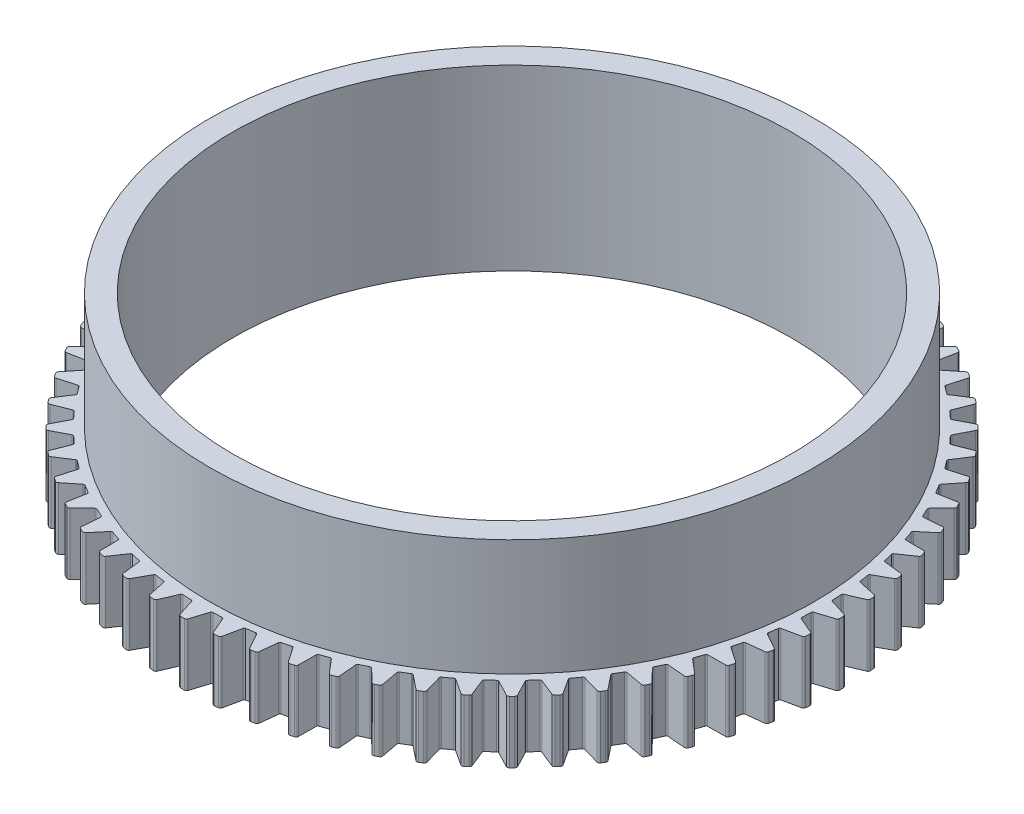
from build123d import *

# Parameters (mm, degrees)
SKETCH1_R           = 36
BOSS_EXTRUDE1_DEPTH = 8
SKETCH2_R           = 39
SKETCH2_R_2         = 36
BOSS_EXTRUDE2_DEPTH = 15


with BuildPart() as part:
    # Sketch1 → Boss-Extrude1 (new body)
    with BuildSketch(Plane(origin=(0, 0, 0), x_dir=(1, 0, 0), z_dir=(0, 1, 0))):
        with BuildLine():
            Line((-0.516428445, 42.290788925), (-1.207230425, 40.115163336))
            ThreePointArc((-1.207230425, 40.115163336), (-1.276964086, 40.016359136), (-1.390897576, 39.975810235))
            ThreePointArc((-1.390897576, 39.975810235), (-1.962706973, 39.951818248), (-2.534114577, 39.919647585))
            ThreePointArc((-2.534114577, 39.919647585), (-2.651473934, 39.948833797), (-2.730556314, 40.040327134))
            Line((-2.730556314, 40.040327134), (-3.631280492, 42.137766057))
            ThreePointArc((-3.631280492, 42.137766057), (-3.754372708, 42.277698039), (-3.936342379, 42.317943441))
            Line((-3.936342379, 42.317943441), (-4.395114549, 42.272758326))
            ThreePointArc((-4.395114549, 42.272758326), (-4.565736235, 42.197785707), (-4.659163894, 42.036528378))
            Line((-4.659163894, 42.036528378), (-5.133390874, 39.803668586))
            ThreePointArc((-5.133390874, 39.803668586), (-5.193104244, 39.698505061), (-5.302514626, 39.646983979))
            ThreePointArc((-5.302514626, 39.646983979), (-5.869218978, 39.567060399), (-6.434721822, 39.479036907))
            ThreePointArc((-6.434721822, 39.479036907), (-6.55437681, 39.49657935), (-6.642046302, 39.579880693))
            Line((-6.642046302, 39.579880693), (-7.744018213, 41.578933466))
            ThreePointArc((-7.744018213, 41.578933466), (-7.880233439, 41.706126491), (-8.065271615, 41.728341953))
            Line((-8.065271615, 41.728341953), (-8.517405756, 41.638406881))
            ThreePointArc((-8.517405756, 41.638406881), (-8.679857251, 41.547071426), (-8.757029047, 41.377433083))
            Line((-8.757029047, 41.377433083), (-9.010113964, 39.108842749))
            ThreePointArc((-9.010113964, 39.108842749), (-9.059231969, 38.998332681), (-9.163065561, 38.936335594))
            ThreePointArc((-9.163065561, 38.936335594), (-9.719207196, 38.801250128), (-10.273359178, 38.658221521))
            ThreePointArc((-10.273359178, 38.658221521), (-10.394157455, 38.663951254), (-10.489569754, 38.738258365))
            Line((-10.489569754, 38.738258365), (-11.782176804, 40.619673017))
            ThreePointArc((-11.782176804, 40.619673017), (-11.930203214, 40.732902146), (-12.116527877, 40.736873722))
            Line((-12.116527877, 40.736873722), (-12.55766969, 40.603054816))
            ThreePointArc((-12.55766969, 40.603054816), (-12.710386496, 40.496236135), (-12.770559223, 40.319850488))
            Line((-12.770559223, 40.319850488), (-12.80006473, 38.037377376))
            ThreePointArc((-12.80006473, 38.037377376), (-12.838114338, 37.922585038), (-12.935371166, 37.850709013))
            ThreePointArc((-12.935371166, 37.850709013), (-13.475594136, 37.661762607), (-14.01305847, 37.46510633))
            ThreePointArc((-14.01305847, 37.46510633), (-14.133836682, 37.458968171), (-14.236072915, 37.523565432))
            Line((-14.236072915, 37.523565432), (-15.706866593, 39.269222912))
            ThreePointArc((-15.706866593, 39.269222912), (-15.86527861, 39.367397686), (-16.051095352, 39.353087127))
            Line((-16.051095352, 39.353087127), (-16.476996399, 39.176673137))
            ThreePointArc((-16.476996399, 39.176673137), (-16.618507771, 39.055399952), (-16.661101934, 38.873965692))
            Line((-16.661101934, 38.873965692), (-16.466743876, 36.599591267))
            ThreePointArc((-16.466743876, 36.599591267), (-16.493358648, 36.481622172), (-16.583102075, 36.400559413))
            ThreePointArc((-16.583102075, 36.400559413), (-17.102203737, 36.159571725), (-17.617804348, 35.911181684))
            ThreePointArc((-17.617804348, 35.911181684), (-17.737399335, 35.893234747), (-17.845474911, 35.947500052))
            Line((-17.845474911, 35.947500052), (-19.48029067, 37.540588723))
            ThreePointArc((-19.48029067, 37.540588723), (-19.647562701, 37.622763666), (-19.831082004, 37.59030879))
            Line((-19.831082004, 37.59030879), (-20.237640627, 37.372998679))
            ThreePointArc((-20.237640627, 37.372998679), (-20.366583731, 37.238438918), (-20.391189124, 37.053703355))
            Line((-20.391189124, 37.053703355), (-19.974839276, 34.809331086))
            ThreePointArc((-19.974839276, 34.809331086), (-19.989762898, 34.68932134), (-20.071128646, 34.599852527))
            ThreePointArc((-20.071128646, 34.599852527), (-20.564109768, 34.3091444), (-21.052881139, 34.011412728))
            ThreePointArc((-21.052881139, 34.011412728), (-21.170141136, 33.981829851), (-21.283015229, 34.025240595))
            Line((-21.283015229, 34.025240595), (-23.066108899, 35.450418143))
            ThreePointArc((-23.066108899, 35.450418143), (-23.240630022, 35.515801865), (-23.420084495, 35.465515232))
            Line((-23.420084495, 35.465515232), (-23.803385311, 35.209401814))
            ThreePointArc((-23.803385311, 35.209401814), (-23.918518357, 35.062851361), (-23.924898017, 34.8765936))
            Line((-23.924898017, 34.8765936), (-23.290566055, 32.683838018))
            ThreePointArc((-23.290566055, 32.683838018), (-23.293654803, 32.562943381), (-23.365859276, 32.465930147))
            ThreePointArc((-23.365859276, 32.465930147), (-23.82797218, 32.128301259), (-24.285207176, 31.784095274))
            ThreePointArc((-24.285207176, 31.784095274), (-24.399002905, 31.743161358), (-24.515588475, 31.775299471))
            Line((-24.515588475, 31.775299471), (-26.42978789, 33.018840657))
            ThreePointArc((-26.42978789, 33.018840657), (-26.609877371, 33.066803477), (-26.78353877, 32.999169373))
            Line((-26.78353877, 32.999169373), (-27.139890384, 32.706719162))
            ThreePointArc((-27.139890384, 32.706719162), (-27.240104575, 32.549589378), (-27.228197062, 32.363603183))
            Line((-27.228197062, 32.363603183), (-26.381991951, 30.243581723))
            ThreePointArc((-26.381991951, 30.243581723), (-26.37321608, 30.122966477), (-26.435563908, 30.019343112))
            ThreePointArc((-26.435563908, 30.019343112), (-26.862358194, 29.638045014), (-27.283653392, 29.250679609))
            ThreePointArc((-27.283653392, 29.250679609), (-27.392888939, 29.198788868), (-27.512063203, 29.219344843))
            Line((-27.512063203, 29.219344843), (-29.538933575, 30.269273686))
            ThreePointArc((-29.538933575, 30.269273686), (-29.722857055, 30.299353696), (-29.889052926, 30.215023475))
            Line((-29.889052926, 30.215023475), (-30.215023475, 29.889052926))
            ThreePointArc((-30.215023475, 29.889052926), (-30.299353696, 29.722857055), (-30.269273686, 29.538933575))
            Line((-30.269273686, 29.538933575), (-29.219344843, 27.512063203))
            ThreePointArc((-29.219344843, 27.512063203), (-29.198788868, 27.392888939), (-29.250679609, 27.283653392))
            ThreePointArc((-29.250679609, 27.283653392), (-29.638045014, 26.862358194), (-30.019343112, 26.435563908))
            ThreePointArc((-30.019343112, 26.435563908), (-30.122966477, 26.37321608), (-30.243581723, 26.381991951))
            Line((-30.243581723, 26.381991951), (-32.363603183, 27.228197062))
            ThreePointArc((-32.363603183, 27.228197062), (-32.549589378, 27.240104575), (-32.706719162, 27.139890384))
            Line((-32.706719162, 27.139890384), (-32.999169373, 26.78353877))
            ThreePointArc((-32.999169373, 26.78353877), (-33.066803477, 26.609877371), (-33.018840657, 26.42978789))
            Line((-33.018840657, 26.42978789), (-31.775299471, 24.515588475))
            ThreePointArc((-31.775299471, 24.515588475), (-31.743161358, 24.399002905), (-31.784095274, 24.285207176))
            ThreePointArc((-31.784095274, 24.285207176), (-32.128301259, 23.82797218), (-32.465930147, 23.365859276))
            ThreePointArc((-32.465930147, 23.365859276), (-32.562943381, 23.293654803), (-32.683838018, 23.290566055))
            Line((-32.683838018, 23.290566055), (-34.8765936, 23.924898017))
            ThreePointArc((-34.8765936, 23.924898017), (-35.062851361, 23.918518357), (-35.209401814, 23.803385311))
            Line((-35.209401814, 23.803385311), (-35.465515232, 23.420084495))
            ThreePointArc((-35.465515232, 23.420084495), (-35.515801865, 23.240630022), (-35.450418143, 23.066108899))
            Line((-35.450418143, 23.066108899), (-34.025240595, 21.283015229))
            ThreePointArc((-34.025240595, 21.283015229), (-33.981829851, 21.170141136), (-34.011412728, 21.052881139))
            ThreePointArc((-34.011412728, 21.052881139), (-34.3091444, 20.564109768), (-34.599852527, 20.071128646))
            ThreePointArc((-34.599852527, 20.071128646), (-34.68932134, 19.989762898), (-34.809331086, 19.974839276))
            Line((-34.809331086, 19.974839276), (-37.053703355, 20.391189124))
            ThreePointArc((-37.053703355, 20.391189124), (-37.238438918, 20.366583731), (-37.372998679, 20.237640627))
            Line((-37.372998679, 20.237640627), (-37.59030879, 19.831082004))
            ThreePointArc((-37.59030879, 19.831082004), (-37.622763666, 19.647562701), (-37.540588723, 19.48029067))
            Line((-37.540588723, 19.48029067), (-35.947500052, 17.845474911))
            ThreePointArc((-35.947500052, 17.845474911), (-35.893234747, 17.737399335), (-35.911181684, 17.617804348))
            ThreePointArc((-35.911181684, 17.617804348), (-36.159571725, 17.102203737), (-36.400559413, 16.583102075))
            ThreePointArc((-36.400559413, 16.583102075), (-36.481622172, 16.493358648), (-36.599591267, 16.466743876))
            Line((-36.599591267, 16.466743876), (-38.873965692, 16.661101934))
            ThreePointArc((-38.873965692, 16.661101934), (-39.055399952, 16.618507771), (-39.176673137, 16.476996399))
            Line((-39.176673137, 16.476996399), (-39.353087127, 16.051095352))
            ThreePointArc((-39.353087127, 16.051095352), (-39.367397686, 15.86527861), (-39.269222912, 15.706866593))
            Line((-39.269222912, 15.706866593), (-37.523565432, 14.236072915))
            ThreePointArc((-37.523565432, 14.236072915), (-37.458968171, 14.133836682), (-37.46510633, 14.01305847))
            ThreePointArc((-37.46510633, 14.01305847), (-37.661762607, 13.475594136), (-37.850709013, 12.935371166))
            ThreePointArc((-37.850709013, 12.935371166), (-37.922585038, 12.838114338), (-38.037377376, 12.80006473))
            Line((-38.037377376, 12.80006473), (-40.319850488, 12.770559223))
            ThreePointArc((-40.319850488, 12.770559223), (-40.496236135, 12.710386496), (-40.603054816, 12.55766969))
            Line((-40.603054816, 12.55766969), (-40.736873722, 12.116527877))
            ThreePointArc((-40.736873722, 12.116527877), (-40.732902146, 11.930203214), (-40.619673017, 11.782176804))
            Line((-40.619673017, 11.782176804), (-38.738258365, 10.489569754))
            ThreePointArc((-38.738258365, 10.489569754), (-38.663951254, 10.394157455), (-38.658221521, 10.273359178))
            ThreePointArc((-38.658221521, 10.273359178), (-38.801250128, 9.719207196), (-38.936335594, 9.163065561))
            ThreePointArc((-38.936335594, 9.163065561), (-38.998332681, 9.059231969), (-39.108842749, 9.010113964))
            Line((-39.108842749, 9.010113964), (-41.377433083, 8.757029047))
            ThreePointArc((-41.377433083, 8.757029047), (-41.547071426, 8.679857251), (-41.638406881, 8.517405756))
            Line((-41.638406881, 8.517405756), (-41.728341953, 8.065271615))
            ThreePointArc((-41.728341953, 8.065271615), (-41.706126491, 7.880233439), (-41.578933466, 7.744018213))
            Line((-41.578933466, 7.744018213), (-39.579880693, 6.642046302))
            ThreePointArc((-39.579880693, 6.642046302), (-39.49657935, 6.55437681), (-39.479036907, 6.434721822))
            ThreePointArc((-39.479036907, 6.434721822), (-39.567060399, 5.869218978), (-39.646983979, 5.302514626))
            ThreePointArc((-39.646983979, 5.302514626), (-39.698505061, 5.193104244), (-39.803668586, 5.133390874))
            Line((-39.803668586, 5.133390874), (-42.036528378, 4.659163894))
            ThreePointArc((-42.036528378, 4.659163894), (-42.197785707, 4.565736235), (-42.272758326, 4.395114549))
            Line((-42.272758326, 4.395114549), (-42.317943441, 3.936342379))
            ThreePointArc((-42.317943441, 3.936342379), (-42.277698039, 3.754372708), (-42.137766057, 3.631280492))
            Line((-42.137766057, 3.631280492), (-40.040327134, 2.730556314))
            ThreePointArc((-40.040327134, 2.730556314), (-39.948833797, 2.651473934), (-39.919647585, 2.534114577))
            ThreePointArc((-39.919647585, 2.534114577), (-39.951818248, 1.962706973), (-39.975810235, 1.390897576))
            ThreePointArc((-39.975810235, 1.390897576), (-40.016359136, 1.276964086), (-40.115163336, 1.207230425))
            Line((-40.115163336, 1.207230425), (-42.290788925, 0.516428445))
            ThreePointArc((-42.290788925, 0.516428445), (-42.442112244, 0.407644684), (-42.5, 0.230495986))
            Line((-42.5, 0.230495986), (-42.5, -0.230495986))
            ThreePointArc((-42.5, -0.230495986), (-42.442112244, -0.407644684), (-42.290788925, -0.516428445))
            Line((-42.290788925, -0.516428445), (-40.115163336, -1.207230425))
            ThreePointArc((-40.115163336, -1.207230425), (-40.016359136, -1.276964086), (-39.975810235, -1.390897576))
            ThreePointArc((-39.975810235, -1.390897576), (-39.951818248, -1.962706973), (-39.919647585, -2.534114577))
            ThreePointArc((-39.919647585, -2.534114577), (-39.948833797, -2.651473934), (-40.040327134, -2.730556314))
            Line((-40.040327134, -2.730556314), (-42.137766057, -3.631280492))
            ThreePointArc((-42.137766057, -3.631280492), (-42.277698039, -3.754372708), (-42.317943441, -3.936342379))
            Line((-42.317943441, -3.936342379), (-42.272758326, -4.395114549))
            ThreePointArc((-42.272758326, -4.395114549), (-42.197785707, -4.565736235), (-42.036528378, -4.659163894))
            Line((-42.036528378, -4.659163894), (-39.803668586, -5.133390874))
            ThreePointArc((-39.803668586, -5.133390874), (-39.698505061, -5.193104244), (-39.646983979, -5.302514626))
            ThreePointArc((-39.646983979, -5.302514626), (-39.567060399, -5.869218978), (-39.479036907, -6.434721822))
            ThreePointArc((-39.479036907, -6.434721822), (-39.49657935, -6.55437681), (-39.579880693, -6.642046302))
            Line((-39.579880693, -6.642046302), (-41.578933466, -7.744018213))
            ThreePointArc((-41.578933466, -7.744018213), (-41.706126491, -7.880233439), (-41.728341953, -8.065271615))
            Line((-41.728341953, -8.065271615), (-41.638406881, -8.517405756))
            ThreePointArc((-41.638406881, -8.517405756), (-41.547071426, -8.679857251), (-41.377433083, -8.757029047))
            Line((-41.377433083, -8.757029047), (-39.108842749, -9.010113964))
            ThreePointArc((-39.108842749, -9.010113964), (-38.998332681, -9.059231969), (-38.936335594, -9.163065561))
            ThreePointArc((-38.936335594, -9.163065561), (-38.801250128, -9.719207196), (-38.658221521, -10.273359178))
            ThreePointArc((-38.658221521, -10.273359178), (-38.663951254, -10.394157455), (-38.738258365, -10.489569754))
            Line((-38.738258365, -10.489569754), (-40.619673017, -11.782176804))
            ThreePointArc((-40.619673017, -11.782176804), (-40.732902146, -11.930203214), (-40.736873722, -12.116527877))
            Line((-40.736873722, -12.116527877), (-40.603054816, -12.55766969))
            ThreePointArc((-40.603054816, -12.55766969), (-40.496236135, -12.710386496), (-40.319850488, -12.770559223))
            Line((-40.319850488, -12.770559223), (-38.037377376, -12.80006473))
            ThreePointArc((-38.037377376, -12.80006473), (-37.922585038, -12.838114338), (-37.850709013, -12.935371166))
            ThreePointArc((-37.850709013, -12.935371166), (-37.661762607, -13.475594136), (-37.46510633, -14.01305847))
            ThreePointArc((-37.46510633, -14.01305847), (-37.458968171, -14.133836682), (-37.523565432, -14.236072915))
            Line((-37.523565432, -14.236072915), (-39.269222912, -15.706866593))
            ThreePointArc((-39.269222912, -15.706866593), (-39.367397686, -15.86527861), (-39.353087127, -16.051095352))
            Line((-39.353087127, -16.051095352), (-39.176673137, -16.476996399))
            ThreePointArc((-39.176673137, -16.476996399), (-39.055399952, -16.618507771), (-38.873965692, -16.661101934))
            Line((-38.873965692, -16.661101934), (-36.599591267, -16.466743876))
            ThreePointArc((-36.599591267, -16.466743876), (-36.481622172, -16.493358648), (-36.400559413, -16.583102075))
            ThreePointArc((-36.400559413, -16.583102075), (-36.159571725, -17.102203737), (-35.911181684, -17.617804348))
            ThreePointArc((-35.911181684, -17.617804348), (-35.893234747, -17.737399335), (-35.947500052, -17.845474911))
            Line((-35.947500052, -17.845474911), (-37.540588723, -19.48029067))
            ThreePointArc((-37.540588723, -19.48029067), (-37.622763666, -19.647562701), (-37.59030879, -19.831082004))
            Line((-37.59030879, -19.831082004), (-37.372998679, -20.237640627))
            ThreePointArc((-37.372998679, -20.237640627), (-37.238438918, -20.366583731), (-37.053703355, -20.391189124))
            Line((-37.053703355, -20.391189124), (-34.809331086, -19.974839276))
            ThreePointArc((-34.809331086, -19.974839276), (-34.68932134, -19.989762898), (-34.599852527, -20.071128646))
            ThreePointArc((-34.599852527, -20.071128646), (-34.3091444, -20.564109768), (-34.011412728, -21.052881139))
            ThreePointArc((-34.011412728, -21.052881139), (-33.981829851, -21.170141136), (-34.025240595, -21.283015229))
            Line((-34.025240595, -21.283015229), (-35.450418143, -23.066108899))
            ThreePointArc((-35.450418143, -23.066108899), (-35.515801865, -23.240630022), (-35.465515232, -23.420084495))
            Line((-35.465515232, -23.420084495), (-35.209401814, -23.803385311))
            ThreePointArc((-35.209401814, -23.803385311), (-35.062851361, -23.918518357), (-34.8765936, -23.924898017))
            Line((-34.8765936, -23.924898017), (-32.683838018, -23.290566055))
            ThreePointArc((-32.683838018, -23.290566055), (-32.562943381, -23.293654803), (-32.465930147, -23.365859276))
            ThreePointArc((-32.465930147, -23.365859276), (-32.128301259, -23.82797218), (-31.784095274, -24.285207176))
            ThreePointArc((-31.784095274, -24.285207176), (-31.743161358, -24.399002905), (-31.775299471, -24.515588475))
            Line((-31.775299471, -24.515588475), (-33.018840657, -26.42978789))
            ThreePointArc((-33.018840657, -26.42978789), (-33.066803477, -26.609877371), (-32.999169373, -26.78353877))
            Line((-32.999169373, -26.78353877), (-32.706719162, -27.139890384))
            ThreePointArc((-32.706719162, -27.139890384), (-32.549589378, -27.240104575), (-32.363603183, -27.228197062))
            Line((-32.363603183, -27.228197062), (-30.243581723, -26.381991951))
            ThreePointArc((-30.243581723, -26.381991951), (-30.122966477, -26.37321608), (-30.019343112, -26.435563908))
            ThreePointArc((-30.019343112, -26.435563908), (-29.638045014, -26.862358194), (-29.250679609, -27.283653392))
            ThreePointArc((-29.250679609, -27.283653392), (-29.198788868, -27.392888939), (-29.219344843, -27.512063203))
            Line((-29.219344843, -27.512063203), (-30.269273686, -29.538933575))
            ThreePointArc((-30.269273686, -29.538933575), (-30.299353696, -29.722857055), (-30.215023475, -29.889052926))
            Line((-30.215023475, -29.889052926), (-29.889052926, -30.215023475))
            ThreePointArc((-29.889052926, -30.215023475), (-29.722857055, -30.299353696), (-29.538933575, -30.269273686))
            Line((-29.538933575, -30.269273686), (-27.512063203, -29.219344843))
            ThreePointArc((-27.512063203, -29.219344843), (-27.392888939, -29.198788868), (-27.283653392, -29.250679609))
            ThreePointArc((-27.283653392, -29.250679609), (-26.862358194, -29.638045014), (-26.435563908, -30.019343112))
            ThreePointArc((-26.435563908, -30.019343112), (-26.37321608, -30.122966477), (-26.381991951, -30.243581723))
            Line((-26.381991951, -30.243581723), (-27.228197062, -32.363603183))
            ThreePointArc((-27.228197062, -32.363603183), (-27.240104575, -32.549589378), (-27.139890384, -32.706719162))
            Line((-27.139890384, -32.706719162), (-26.78353877, -32.999169373))
            ThreePointArc((-26.78353877, -32.999169373), (-26.609877371, -33.066803477), (-26.42978789, -33.018840657))
            Line((-26.42978789, -33.018840657), (-24.515588475, -31.775299471))
            ThreePointArc((-24.515588475, -31.775299471), (-24.399002905, -31.743161358), (-24.285207176, -31.784095274))
            ThreePointArc((-24.285207176, -31.784095274), (-23.82797218, -32.128301259), (-23.365859276, -32.465930147))
            ThreePointArc((-23.365859276, -32.465930147), (-23.293654803, -32.562943381), (-23.290566055, -32.683838018))
            Line((-23.290566055, -32.683838018), (-23.924898017, -34.8765936))
            ThreePointArc((-23.924898017, -34.8765936), (-23.918518357, -35.062851361), (-23.803385311, -35.209401814))
            Line((-23.803385311, -35.209401814), (-23.420084495, -35.465515232))
            ThreePointArc((-23.420084495, -35.465515232), (-23.240630022, -35.515801865), (-23.066108899, -35.450418143))
            Line((-23.066108899, -35.450418143), (-21.283015229, -34.025240595))
            ThreePointArc((-21.283015229, -34.025240595), (-21.170141136, -33.981829851), (-21.052881139, -34.011412728))
            ThreePointArc((-21.052881139, -34.011412728), (-20.564109768, -34.3091444), (-20.071128646, -34.599852527))
            ThreePointArc((-20.071128646, -34.599852527), (-19.989762898, -34.68932134), (-19.974839276, -34.809331086))
            Line((-19.974839276, -34.809331086), (-20.391189124, -37.053703355))
            ThreePointArc((-20.391189124, -37.053703355), (-20.366583731, -37.238438918), (-20.237640627, -37.372998679))
            Line((-20.237640627, -37.372998679), (-19.831082004, -37.59030879))
            ThreePointArc((-19.831082004, -37.59030879), (-19.647562701, -37.622763666), (-19.48029067, -37.540588723))
            Line((-19.48029067, -37.540588723), (-17.845474911, -35.947500052))
            ThreePointArc((-17.845474911, -35.947500052), (-17.737399335, -35.893234747), (-17.617804348, -35.911181684))
            ThreePointArc((-17.617804348, -35.911181684), (-17.102203737, -36.159571725), (-16.583102075, -36.400559413))
            ThreePointArc((-16.583102075, -36.400559413), (-16.493358648, -36.481622172), (-16.466743876, -36.599591267))
            Line((-16.466743876, -36.599591267), (-16.661101934, -38.873965692))
            ThreePointArc((-16.661101934, -38.873965692), (-16.618507771, -39.055399952), (-16.476996399, -39.176673137))
            Line((-16.476996399, -39.176673137), (-16.051095352, -39.353087127))
            ThreePointArc((-16.051095352, -39.353087127), (-15.86527861, -39.367397686), (-15.706866593, -39.269222912))
            Line((-15.706866593, -39.269222912), (-14.236072915, -37.523565432))
            ThreePointArc((-14.236072915, -37.523565432), (-14.133836682, -37.458968171), (-14.01305847, -37.46510633))
            ThreePointArc((-14.01305847, -37.46510633), (-13.475594136, -37.661762607), (-12.935371166, -37.850709013))
            ThreePointArc((-12.935371166, -37.850709013), (-12.838114338, -37.922585038), (-12.80006473, -38.037377376))
            Line((-12.80006473, -38.037377376), (-12.770559223, -40.319850488))
            ThreePointArc((-12.770559223, -40.319850488), (-12.710386496, -40.496236135), (-12.55766969, -40.603054816))
            Line((-12.55766969, -40.603054816), (-12.116527877, -40.736873722))
            ThreePointArc((-12.116527877, -40.736873722), (-11.930203214, -40.732902146), (-11.782176804, -40.619673017))
            Line((-11.782176804, -40.619673017), (-10.489569754, -38.738258365))
            ThreePointArc((-10.489569754, -38.738258365), (-10.394157455, -38.663951254), (-10.273359178, -38.658221521))
            ThreePointArc((-10.273359178, -38.658221521), (-9.719207196, -38.801250128), (-9.163065561, -38.936335594))
            ThreePointArc((-9.163065561, -38.936335594), (-9.059231969, -38.998332681), (-9.010113964, -39.108842749))
            Line((-9.010113964, -39.108842749), (-8.757029047, -41.377433083))
            ThreePointArc((-8.757029047, -41.377433083), (-8.679857251, -41.547071426), (-8.517405756, -41.638406881))
            Line((-8.517405756, -41.638406881), (-8.065271615, -41.728341953))
            ThreePointArc((-8.065271615, -41.728341953), (-7.880233439, -41.706126491), (-7.744018213, -41.578933466))
            Line((-7.744018213, -41.578933466), (-6.642046302, -39.579880693))
            ThreePointArc((-6.642046302, -39.579880693), (-6.55437681, -39.49657935), (-6.434721822, -39.479036907))
            ThreePointArc((-6.434721822, -39.479036907), (-5.869218978, -39.567060399), (-5.302514626, -39.646983979))
            ThreePointArc((-5.302514626, -39.646983979), (-5.193104244, -39.698505061), (-5.133390874, -39.803668586))
            Line((-5.133390874, -39.803668586), (-4.659163894, -42.036528378))
            ThreePointArc((-4.659163894, -42.036528378), (-4.565736235, -42.197785707), (-4.395114549, -42.272758326))
            Line((-4.395114549, -42.272758326), (-3.936342379, -42.317943441))
            ThreePointArc((-3.936342379, -42.317943441), (-3.754372708, -42.277698039), (-3.631280492, -42.137766057))
            Line((-3.631280492, -42.137766057), (-2.730556314, -40.040327134))
            ThreePointArc((-2.730556314, -40.040327134), (-2.651473934, -39.948833797), (-2.534114577, -39.919647585))
            ThreePointArc((-2.534114577, -39.919647585), (-1.962706973, -39.951818248), (-1.390897576, -39.975810235))
            ThreePointArc((-1.390897576, -39.975810235), (-1.276964086, -40.016359136), (-1.207230425, -40.115163336))
            Line((-1.207230425, -40.115163336), (-0.516428445, -42.290788925))
            ThreePointArc((-0.516428445, -42.290788925), (-0.407644684, -42.442112244), (-0.230495986, -42.5))
            Line((-0.230495986, -42.5), (0.230495986, -42.5))
            ThreePointArc((0.230495986, -42.5), (0.407644684, -42.442112244), (0.516428445, -42.290788925))
            Line((0.516428445, -42.290788925), (1.207230425, -40.115163336))
            ThreePointArc((1.207230425, -40.115163336), (1.276964086, -40.016359136), (1.390897576, -39.975810235))
            ThreePointArc((1.390897576, -39.975810235), (1.962706973, -39.951818248), (2.534114577, -39.919647585))
            ThreePointArc((2.534114577, -39.919647585), (2.651473934, -39.948833797), (2.730556314, -40.040327134))
            Line((2.730556314, -40.040327134), (3.631280492, -42.137766057))
            ThreePointArc((3.631280492, -42.137766057), (3.754372708, -42.277698039), (3.936342379, -42.317943441))
            Line((3.936342379, -42.317943441), (4.395114549, -42.272758326))
            ThreePointArc((4.395114549, -42.272758326), (4.565736235, -42.197785707), (4.659163894, -42.036528378))
            Line((4.659163894, -42.036528378), (5.133390874, -39.803668586))
            ThreePointArc((5.133390874, -39.803668586), (5.193104244, -39.698505061), (5.302514626, -39.646983979))
            ThreePointArc((5.302514626, -39.646983979), (5.869218978, -39.567060399), (6.434721822, -39.479036907))
            ThreePointArc((6.434721822, -39.479036907), (6.55437681, -39.49657935), (6.642046302, -39.579880693))
            Line((6.642046302, -39.579880693), (7.744018213, -41.578933466))
            ThreePointArc((7.744018213, -41.578933466), (7.880233439, -41.706126491), (8.065271615, -41.728341953))
            Line((8.065271615, -41.728341953), (8.517405756, -41.638406881))
            ThreePointArc((8.517405756, -41.638406881), (8.679857251, -41.547071426), (8.757029047, -41.377433083))
            Line((8.757029047, -41.377433083), (9.010113964, -39.108842749))
            ThreePointArc((9.010113964, -39.108842749), (9.059231969, -38.998332681), (9.163065561, -38.936335594))
            ThreePointArc((9.163065561, -38.936335594), (9.719207196, -38.801250128), (10.273359178, -38.658221521))
            ThreePointArc((10.273359178, -38.658221521), (10.394157455, -38.663951254), (10.489569754, -38.738258365))
            Line((10.489569754, -38.738258365), (11.782176804, -40.619673017))
            ThreePointArc((11.782176804, -40.619673017), (11.930203214, -40.732902146), (12.116527877, -40.736873722))
            Line((12.116527877, -40.736873722), (12.55766969, -40.603054816))
            ThreePointArc((12.55766969, -40.603054816), (12.710386496, -40.496236135), (12.770559223, -40.319850488))
            Line((12.770559223, -40.319850488), (12.80006473, -38.037377376))
            ThreePointArc((12.80006473, -38.037377376), (12.838114338, -37.922585038), (12.935371166, -37.850709013))
            ThreePointArc((12.935371166, -37.850709013), (13.475594136, -37.661762607), (14.01305847, -37.46510633))
            ThreePointArc((14.01305847, -37.46510633), (14.133836682, -37.458968171), (14.236072915, -37.523565432))
            Line((14.236072915, -37.523565432), (15.706866593, -39.269222912))
            ThreePointArc((15.706866593, -39.269222912), (15.86527861, -39.367397686), (16.051095352, -39.353087127))
            Line((16.051095352, -39.353087127), (16.476996399, -39.176673137))
            ThreePointArc((16.476996399, -39.176673137), (16.618507771, -39.055399952), (16.661101934, -38.873965692))
            Line((16.661101934, -38.873965692), (16.466743876, -36.599591267))
            ThreePointArc((16.466743876, -36.599591267), (16.493358648, -36.481622172), (16.583102075, -36.400559413))
            ThreePointArc((16.583102075, -36.400559413), (17.102203737, -36.159571725), (17.617804348, -35.911181684))
            ThreePointArc((17.617804348, -35.911181684), (17.737399335, -35.893234747), (17.845474911, -35.947500052))
            Line((17.845474911, -35.947500052), (19.48029067, -37.540588723))
            ThreePointArc((19.48029067, -37.540588723), (19.647562701, -37.622763666), (19.831082004, -37.59030879))
            Line((19.831082004, -37.59030879), (20.237640627, -37.372998679))
            ThreePointArc((20.237640627, -37.372998679), (20.366583731, -37.238438918), (20.391189124, -37.053703355))
            Line((20.391189124, -37.053703355), (19.974839276, -34.809331086))
            ThreePointArc((19.974839276, -34.809331086), (19.989762898, -34.68932134), (20.071128646, -34.599852527))
            ThreePointArc((20.071128646, -34.599852527), (20.564109768, -34.3091444), (21.052881139, -34.011412728))
            ThreePointArc((21.052881139, -34.011412728), (21.170141136, -33.981829851), (21.283015229, -34.025240595))
            Line((21.283015229, -34.025240595), (23.066108899, -35.450418143))
            ThreePointArc((23.066108899, -35.450418143), (23.240630022, -35.515801865), (23.420084495, -35.465515232))
            Line((23.420084495, -35.465515232), (23.803385311, -35.209401814))
            ThreePointArc((23.803385311, -35.209401814), (23.918518357, -35.062851361), (23.924898017, -34.8765936))
            Line((23.924898017, -34.8765936), (23.290566055, -32.683838018))
            ThreePointArc((23.290566055, -32.683838018), (23.293654803, -32.562943381), (23.365859276, -32.465930147))
            ThreePointArc((23.365859276, -32.465930147), (23.82797218, -32.128301259), (24.285207176, -31.784095274))
            ThreePointArc((24.285207176, -31.784095274), (24.399002905, -31.743161358), (24.515588475, -31.775299471))
            Line((24.515588475, -31.775299471), (26.42978789, -33.018840657))
            ThreePointArc((26.42978789, -33.018840657), (26.609877371, -33.066803477), (26.78353877, -32.999169373))
            Line((26.78353877, -32.999169373), (27.139890384, -32.706719162))
            ThreePointArc((27.139890384, -32.706719162), (27.240104575, -32.549589378), (27.228197062, -32.363603183))
            Line((27.228197062, -32.363603183), (26.381991951, -30.243581723))
            ThreePointArc((26.381991951, -30.243581723), (26.37321608, -30.122966477), (26.435563908, -30.019343112))
            ThreePointArc((26.435563908, -30.019343112), (26.862358194, -29.638045014), (27.283653392, -29.250679609))
            ThreePointArc((27.283653392, -29.250679609), (27.392888939, -29.198788868), (27.512063203, -29.219344843))
            Line((27.512063203, -29.219344843), (29.538933575, -30.269273686))
            ThreePointArc((29.538933575, -30.269273686), (29.722857055, -30.299353696), (29.889052926, -30.215023475))
            Line((29.889052926, -30.215023475), (30.215023475, -29.889052926))
            ThreePointArc((30.215023475, -29.889052926), (30.299353696, -29.722857055), (30.269273686, -29.538933575))
            Line((30.269273686, -29.538933575), (29.219344843, -27.512063203))
            ThreePointArc((29.219344843, -27.512063203), (29.198788868, -27.392888939), (29.250679609, -27.283653392))
            ThreePointArc((29.250679609, -27.283653392), (29.638045014, -26.862358194), (30.019343112, -26.435563908))
            ThreePointArc((30.019343112, -26.435563908), (30.122966477, -26.37321608), (30.243581723, -26.381991951))
            Line((30.243581723, -26.381991951), (32.363603183, -27.228197062))
            ThreePointArc((32.363603183, -27.228197062), (32.549589378, -27.240104575), (32.706719162, -27.139890384))
            Line((32.706719162, -27.139890384), (32.999169373, -26.78353877))
            ThreePointArc((32.999169373, -26.78353877), (33.066803477, -26.609877371), (33.018840657, -26.42978789))
            Line((33.018840657, -26.42978789), (31.775299471, -24.515588475))
            ThreePointArc((31.775299471, -24.515588475), (31.743161358, -24.399002905), (31.784095274, -24.285207176))
            ThreePointArc((31.784095274, -24.285207176), (32.128301259, -23.82797218), (32.465930147, -23.365859276))
            ThreePointArc((32.465930147, -23.365859276), (32.562943381, -23.293654803), (32.683838018, -23.290566055))
            Line((32.683838018, -23.290566055), (34.8765936, -23.924898017))
            ThreePointArc((34.8765936, -23.924898017), (35.062851361, -23.918518357), (35.209401814, -23.803385311))
            Line((35.209401814, -23.803385311), (35.465515232, -23.420084495))
            ThreePointArc((35.465515232, -23.420084495), (35.515801865, -23.240630022), (35.450418143, -23.066108899))
            Line((35.450418143, -23.066108899), (34.025240595, -21.283015229))
            ThreePointArc((34.025240595, -21.283015229), (33.981829851, -21.170141136), (34.011412728, -21.052881139))
            ThreePointArc((34.011412728, -21.052881139), (34.3091444, -20.564109768), (34.599852527, -20.071128646))
            ThreePointArc((34.599852527, -20.071128646), (34.68932134, -19.989762898), (34.809331086, -19.974839276))
            Line((34.809331086, -19.974839276), (37.053703355, -20.391189124))
            ThreePointArc((37.053703355, -20.391189124), (37.238438918, -20.366583731), (37.372998679, -20.237640627))
            Line((37.372998679, -20.237640627), (37.59030879, -19.831082004))
            ThreePointArc((37.59030879, -19.831082004), (37.622763666, -19.647562701), (37.540588723, -19.48029067))
            Line((37.540588723, -19.48029067), (35.947500052, -17.845474911))
            ThreePointArc((35.947500052, -17.845474911), (35.893234747, -17.737399335), (35.911181684, -17.617804348))
            ThreePointArc((35.911181684, -17.617804348), (36.159571725, -17.102203737), (36.400559413, -16.583102075))
            ThreePointArc((36.400559413, -16.583102075), (36.481622172, -16.493358648), (36.599591267, -16.466743876))
            Line((36.599591267, -16.466743876), (38.873965692, -16.661101934))
            ThreePointArc((38.873965692, -16.661101934), (39.055399952, -16.618507771), (39.176673137, -16.476996399))
            Line((39.176673137, -16.476996399), (39.353087127, -16.051095352))
            ThreePointArc((39.353087127, -16.051095352), (39.367397686, -15.86527861), (39.269222912, -15.706866593))
            Line((39.269222912, -15.706866593), (37.523565432, -14.236072915))
            ThreePointArc((37.523565432, -14.236072915), (37.458968171, -14.133836682), (37.46510633, -14.01305847))
            ThreePointArc((37.46510633, -14.01305847), (37.661762607, -13.475594136), (37.850709013, -12.935371166))
            ThreePointArc((37.850709013, -12.935371166), (37.922585038, -12.838114338), (38.037377376, -12.80006473))
            Line((38.037377376, -12.80006473), (40.319850488, -12.770559223))
            ThreePointArc((40.319850488, -12.770559223), (40.496236135, -12.710386496), (40.603054816, -12.55766969))
            Line((40.603054816, -12.55766969), (40.736873722, -12.116527877))
            ThreePointArc((40.736873722, -12.116527877), (40.732902146, -11.930203214), (40.619673017, -11.782176804))
            Line((40.619673017, -11.782176804), (38.738258365, -10.489569754))
            ThreePointArc((38.738258365, -10.489569754), (38.663951254, -10.394157455), (38.658221521, -10.273359178))
            ThreePointArc((38.658221521, -10.273359178), (38.801250128, -9.719207196), (38.936335594, -9.163065561))
            ThreePointArc((38.936335594, -9.163065561), (38.998332681, -9.059231969), (39.108842749, -9.010113964))
            Line((39.108842749, -9.010113964), (41.377433083, -8.757029047))
            ThreePointArc((41.377433083, -8.757029047), (41.547071426, -8.679857251), (41.638406881, -8.517405756))
            Line((41.638406881, -8.517405756), (41.728341953, -8.065271615))
            ThreePointArc((41.728341953, -8.065271615), (41.706126491, -7.880233439), (41.578933466, -7.744018213))
            Line((41.578933466, -7.744018213), (39.579880693, -6.642046302))
            ThreePointArc((39.579880693, -6.642046302), (39.49657935, -6.55437681), (39.479036907, -6.434721822))
            ThreePointArc((39.479036907, -6.434721822), (39.567060399, -5.869218978), (39.646983979, -5.302514626))
            ThreePointArc((39.646983979, -5.302514626), (39.698505061, -5.193104244), (39.803668586, -5.133390874))
            Line((39.803668586, -5.133390874), (42.036528378, -4.659163894))
            ThreePointArc((42.036528378, -4.659163894), (42.197785707, -4.565736235), (42.272758326, -4.395114549))
            Line((42.272758326, -4.395114549), (42.317943441, -3.936342379))
            ThreePointArc((42.317943441, -3.936342379), (42.277698039, -3.754372708), (42.137766057, -3.631280492))
            Line((42.137766057, -3.631280492), (40.040327134, -2.730556314))
            ThreePointArc((40.040327134, -2.730556314), (39.948833797, -2.651473934), (39.919647585, -2.534114577))
            ThreePointArc((39.919647585, -2.534114577), (39.951818248, -1.962706973), (39.975810235, -1.390897576))
            ThreePointArc((39.975810235, -1.390897576), (40.016359136, -1.276964086), (40.115163336, -1.207230425))
            Line((40.115163336, -1.207230425), (42.290788925, -0.516428445))
            ThreePointArc((42.290788925, -0.516428445), (42.442112244, -0.407644684), (42.5, -0.230495986))
            Line((42.5, -0.230495986), (42.5, 0.230495986))
            ThreePointArc((42.5, 0.230495986), (42.442112244, 0.407644684), (42.290788925, 0.516428445))
            Line((42.290788925, 0.516428445), (40.115163336, 1.207230425))
            ThreePointArc((40.115163336, 1.207230425), (40.016359136, 1.276964086), (39.975810235, 1.390897576))
            ThreePointArc((39.975810235, 1.390897576), (39.951818248, 1.962706973), (39.919647585, 2.534114577))
            ThreePointArc((39.919647585, 2.534114577), (39.948833797, 2.651473934), (40.040327134, 2.730556314))
            Line((40.040327134, 2.730556314), (42.137766057, 3.631280492))
            ThreePointArc((42.137766057, 3.631280492), (42.277698039, 3.754372708), (42.317943441, 3.936342379))
            Line((42.317943441, 3.936342379), (42.272758326, 4.395114549))
            ThreePointArc((42.272758326, 4.395114549), (42.197785707, 4.565736235), (42.036528378, 4.659163894))
            Line((42.036528378, 4.659163894), (39.803668586, 5.133390874))
            ThreePointArc((39.803668586, 5.133390874), (39.698505061, 5.193104244), (39.646983979, 5.302514626))
            ThreePointArc((39.646983979, 5.302514626), (39.567060399, 5.869218978), (39.479036907, 6.434721822))
            ThreePointArc((39.479036907, 6.434721822), (39.49657935, 6.55437681), (39.579880693, 6.642046302))
            Line((39.579880693, 6.642046302), (41.578933466, 7.744018213))
            ThreePointArc((41.578933466, 7.744018213), (41.706126491, 7.880233439), (41.728341953, 8.065271615))
            Line((41.728341953, 8.065271615), (41.638406881, 8.517405756))
            ThreePointArc((41.638406881, 8.517405756), (41.547071426, 8.679857251), (41.377433083, 8.757029047))
            Line((41.377433083, 8.757029047), (39.108842749, 9.010113964))
            ThreePointArc((39.108842749, 9.010113964), (38.998332681, 9.059231969), (38.936335594, 9.163065561))
            ThreePointArc((38.936335594, 9.163065561), (38.801250128, 9.719207196), (38.658221521, 10.273359178))
            ThreePointArc((38.658221521, 10.273359178), (38.663951254, 10.394157455), (38.738258365, 10.489569754))
            Line((38.738258365, 10.489569754), (40.619673017, 11.782176804))
            ThreePointArc((40.619673017, 11.782176804), (40.732902146, 11.930203214), (40.736873722, 12.116527877))
            Line((40.736873722, 12.116527877), (40.603054816, 12.55766969))
            ThreePointArc((40.603054816, 12.55766969), (40.496236135, 12.710386496), (40.319850488, 12.770559223))
            Line((40.319850488, 12.770559223), (38.037377376, 12.80006473))
            ThreePointArc((38.037377376, 12.80006473), (37.922585038, 12.838114338), (37.850709013, 12.935371166))
            ThreePointArc((37.850709013, 12.935371166), (37.661762607, 13.475594136), (37.46510633, 14.01305847))
            ThreePointArc((37.46510633, 14.01305847), (37.458968171, 14.133836682), (37.523565432, 14.236072915))
            Line((37.523565432, 14.236072915), (39.269222912, 15.706866593))
            ThreePointArc((39.269222912, 15.706866593), (39.367397686, 15.86527861), (39.353087127, 16.051095352))
            Line((39.353087127, 16.051095352), (39.176673137, 16.476996399))
            ThreePointArc((39.176673137, 16.476996399), (39.055399952, 16.618507771), (38.873965692, 16.661101934))
            Line((38.873965692, 16.661101934), (36.599591267, 16.466743876))
            ThreePointArc((36.599591267, 16.466743876), (36.481622172, 16.493358648), (36.400559413, 16.583102075))
            ThreePointArc((36.400559413, 16.583102075), (36.159571725, 17.102203737), (35.911181684, 17.617804348))
            ThreePointArc((35.911181684, 17.617804348), (35.893234747, 17.737399335), (35.947500052, 17.845474911))
            Line((35.947500052, 17.845474911), (37.540588723, 19.48029067))
            ThreePointArc((37.540588723, 19.48029067), (37.622763666, 19.647562701), (37.59030879, 19.831082004))
            Line((37.59030879, 19.831082004), (37.372998679, 20.237640627))
            ThreePointArc((37.372998679, 20.237640627), (37.238438918, 20.366583731), (37.053703355, 20.391189124))
            Line((37.053703355, 20.391189124), (34.809331086, 19.974839276))
            ThreePointArc((34.809331086, 19.974839276), (34.68932134, 19.989762898), (34.599852527, 20.071128646))
            ThreePointArc((34.599852527, 20.071128646), (34.3091444, 20.564109768), (34.011412728, 21.052881139))
            ThreePointArc((34.011412728, 21.052881139), (33.981829851, 21.170141136), (34.025240595, 21.283015229))
            Line((34.025240595, 21.283015229), (35.450418143, 23.066108899))
            ThreePointArc((35.450418143, 23.066108899), (35.515801865, 23.240630022), (35.465515232, 23.420084495))
            Line((35.465515232, 23.420084495), (35.209401814, 23.803385311))
            ThreePointArc((35.209401814, 23.803385311), (35.062851361, 23.918518357), (34.8765936, 23.924898017))
            Line((34.8765936, 23.924898017), (32.683838018, 23.290566055))
            ThreePointArc((32.683838018, 23.290566055), (32.562943381, 23.293654803), (32.465930147, 23.365859276))
            ThreePointArc((32.465930147, 23.365859276), (32.128301259, 23.82797218), (31.784095274, 24.285207176))
            ThreePointArc((31.784095274, 24.285207176), (31.743161358, 24.399002905), (31.775299471, 24.515588475))
            Line((31.775299471, 24.515588475), (33.018840657, 26.42978789))
            ThreePointArc((33.018840657, 26.42978789), (33.066803477, 26.609877371), (32.999169373, 26.78353877))
            Line((32.999169373, 26.78353877), (32.706719162, 27.139890384))
            ThreePointArc((32.706719162, 27.139890384), (32.549589378, 27.240104575), (32.363603183, 27.228197062))
            Line((32.363603183, 27.228197062), (30.243581723, 26.381991951))
            ThreePointArc((30.243581723, 26.381991951), (30.122966477, 26.37321608), (30.019343112, 26.435563908))
            ThreePointArc((30.019343112, 26.435563908), (29.638045014, 26.862358194), (29.250679609, 27.283653392))
            ThreePointArc((29.250679609, 27.283653392), (29.198788868, 27.392888939), (29.219344843, 27.512063203))
            Line((29.219344843, 27.512063203), (30.269273686, 29.538933575))
            ThreePointArc((30.269273686, 29.538933575), (30.299353696, 29.722857055), (30.215023475, 29.889052926))
            Line((30.215023475, 29.889052926), (29.889052926, 30.215023475))
            ThreePointArc((29.889052926, 30.215023475), (29.722857055, 30.299353696), (29.538933575, 30.269273686))
            Line((29.538933575, 30.269273686), (27.512063203, 29.219344843))
            ThreePointArc((27.512063203, 29.219344843), (27.392888939, 29.198788868), (27.283653392, 29.250679609))
            ThreePointArc((27.283653392, 29.250679609), (26.862358194, 29.638045014), (26.435563908, 30.019343112))
            ThreePointArc((26.435563908, 30.019343112), (26.37321608, 30.122966477), (26.381991951, 30.243581723))
            Line((26.381991951, 30.243581723), (27.228197062, 32.363603183))
            ThreePointArc((27.228197062, 32.363603183), (27.240104575, 32.549589378), (27.139890384, 32.706719162))
            Line((27.139890384, 32.706719162), (26.78353877, 32.999169373))
            ThreePointArc((26.78353877, 32.999169373), (26.609877371, 33.066803477), (26.42978789, 33.018840657))
            Line((26.42978789, 33.018840657), (24.515588475, 31.775299471))
            ThreePointArc((24.515588475, 31.775299471), (24.399002905, 31.743161358), (24.285207176, 31.784095274))
            ThreePointArc((24.285207176, 31.784095274), (23.82797218, 32.128301259), (23.365859276, 32.465930147))
            ThreePointArc((23.365859276, 32.465930147), (23.293654803, 32.562943381), (23.290566055, 32.683838018))
            Line((23.290566055, 32.683838018), (23.924898017, 34.8765936))
            ThreePointArc((23.924898017, 34.8765936), (23.918518357, 35.062851361), (23.803385311, 35.209401814))
            Line((23.803385311, 35.209401814), (23.420084495, 35.465515232))
            ThreePointArc((23.420084495, 35.465515232), (23.240630022, 35.515801865), (23.066108899, 35.450418143))
            Line((23.066108899, 35.450418143), (21.283015229, 34.025240595))
            ThreePointArc((21.283015229, 34.025240595), (21.170141136, 33.981829851), (21.052881139, 34.011412728))
            ThreePointArc((21.052881139, 34.011412728), (20.564109768, 34.3091444), (20.071128646, 34.599852527))
            ThreePointArc((20.071128646, 34.599852527), (19.989762898, 34.68932134), (19.974839276, 34.809331086))
            Line((19.974839276, 34.809331086), (20.391189124, 37.053703355))
            ThreePointArc((20.391189124, 37.053703355), (20.366583731, 37.238438918), (20.237640627, 37.372998679))
            Line((20.237640627, 37.372998679), (19.831082004, 37.59030879))
            ThreePointArc((19.831082004, 37.59030879), (19.647562701, 37.622763666), (19.48029067, 37.540588723))
            Line((19.48029067, 37.540588723), (17.845474911, 35.947500052))
            ThreePointArc((17.845474911, 35.947500052), (17.737399335, 35.893234747), (17.617804348, 35.911181684))
            ThreePointArc((17.617804348, 35.911181684), (17.102203737, 36.159571725), (16.583102075, 36.400559413))
            ThreePointArc((16.583102075, 36.400559413), (16.493358648, 36.481622172), (16.466743876, 36.599591267))
            Line((16.466743876, 36.599591267), (16.661101934, 38.873965692))
            ThreePointArc((16.661101934, 38.873965692), (16.618507771, 39.055399952), (16.476996399, 39.176673137))
            Line((16.476996399, 39.176673137), (16.051095352, 39.353087127))
            ThreePointArc((16.051095352, 39.353087127), (15.86527861, 39.367397686), (15.706866593, 39.269222912))
            Line((15.706866593, 39.269222912), (14.236072915, 37.523565432))
            ThreePointArc((14.236072915, 37.523565432), (14.133836682, 37.458968171), (14.01305847, 37.46510633))
            ThreePointArc((14.01305847, 37.46510633), (13.475594136, 37.661762607), (12.935371166, 37.850709013))
            ThreePointArc((12.935371166, 37.850709013), (12.838114338, 37.922585038), (12.80006473, 38.037377376))
            Line((12.80006473, 38.037377376), (12.770559223, 40.319850488))
            ThreePointArc((12.770559223, 40.319850488), (12.710386496, 40.496236135), (12.55766969, 40.603054816))
            Line((12.55766969, 40.603054816), (12.116527877, 40.736873722))
            ThreePointArc((12.116527877, 40.736873722), (11.930203214, 40.732902146), (11.782176804, 40.619673017))
            Line((11.782176804, 40.619673017), (10.489569754, 38.738258365))
            ThreePointArc((10.489569754, 38.738258365), (10.394157455, 38.663951254), (10.273359178, 38.658221521))
            ThreePointArc((10.273359178, 38.658221521), (9.719207196, 38.801250128), (9.163065561, 38.936335594))
            ThreePointArc((9.163065561, 38.936335594), (9.059231969, 38.998332681), (9.010113964, 39.108842749))
            Line((9.010113964, 39.108842749), (8.757029047, 41.377433083))
            ThreePointArc((8.757029047, 41.377433083), (8.679857251, 41.547071426), (8.517405756, 41.638406881))
            Line((8.517405756, 41.638406881), (8.065271615, 41.728341953))
            ThreePointArc((8.065271615, 41.728341953), (7.880233439, 41.706126491), (7.744018213, 41.578933466))
            Line((7.744018213, 41.578933466), (6.642046302, 39.579880693))
            ThreePointArc((6.642046302, 39.579880693), (6.55437681, 39.49657935), (6.434721822, 39.479036907))
            ThreePointArc((6.434721822, 39.479036907), (5.869218978, 39.567060399), (5.302514626, 39.646983979))
            ThreePointArc((5.302514626, 39.646983979), (5.193104244, 39.698505061), (5.133390874, 39.803668586))
            Line((5.133390874, 39.803668586), (4.659163894, 42.036528378))
            ThreePointArc((4.659163894, 42.036528378), (4.565736235, 42.197785707), (4.395114549, 42.272758326))
            Line((4.395114549, 42.272758326), (3.936342379, 42.317943441))
            ThreePointArc((3.936342379, 42.317943441), (3.754372708, 42.277698039), (3.631280492, 42.137766057))
            Line((3.631280492, 42.137766057), (2.730556314, 40.040327134))
            ThreePointArc((2.730556314, 40.040327134), (2.651473934, 39.948833797), (2.534114577, 39.919647585))
            ThreePointArc((2.534114577, 39.919647585), (1.962706973, 39.951818248), (1.390897576, 39.975810235))
            ThreePointArc((1.390897576, 39.975810235), (1.276964086, 40.016359136), (1.207230425, 40.115163336))
            Line((1.207230425, 40.115163336), (0.516428445, 42.290788925))
            ThreePointArc((0.516428445, 42.290788925), (0.407644684, 42.442112244), (0.230495986, 42.5))
            Line((0.230495986, 42.5), (-0.230495986, 42.5))
            ThreePointArc((-0.230495986, 42.5), (-0.407644684, 42.442112244), (-0.516428445, 42.290788925))
        make_face()
        with Locations(Location((0, 0, 0), (0, 0, 270))):
            Circle(SKETCH1_R, mode=Mode.SUBTRACT)
    extrude(amount=BOSS_EXTRUDE1_DEPTH)

    # Sketch2 → Boss-Extrude2 (add)
    with BuildSketch(Plane(origin=(0, 8, 0), x_dir=(1, 0, 0), z_dir=(0, 1, 0))):
        with Locations(Location((0, 0, 0), (0, 0, 270))):
            Circle(SKETCH2_R)
        with Locations(Location((0, 0, 0), (0, 0, 270))):
            Circle(SKETCH2_R_2, mode=Mode.SUBTRACT)
    extrude(amount=BOSS_EXTRUDE2_DEPTH)


solid = part.part
